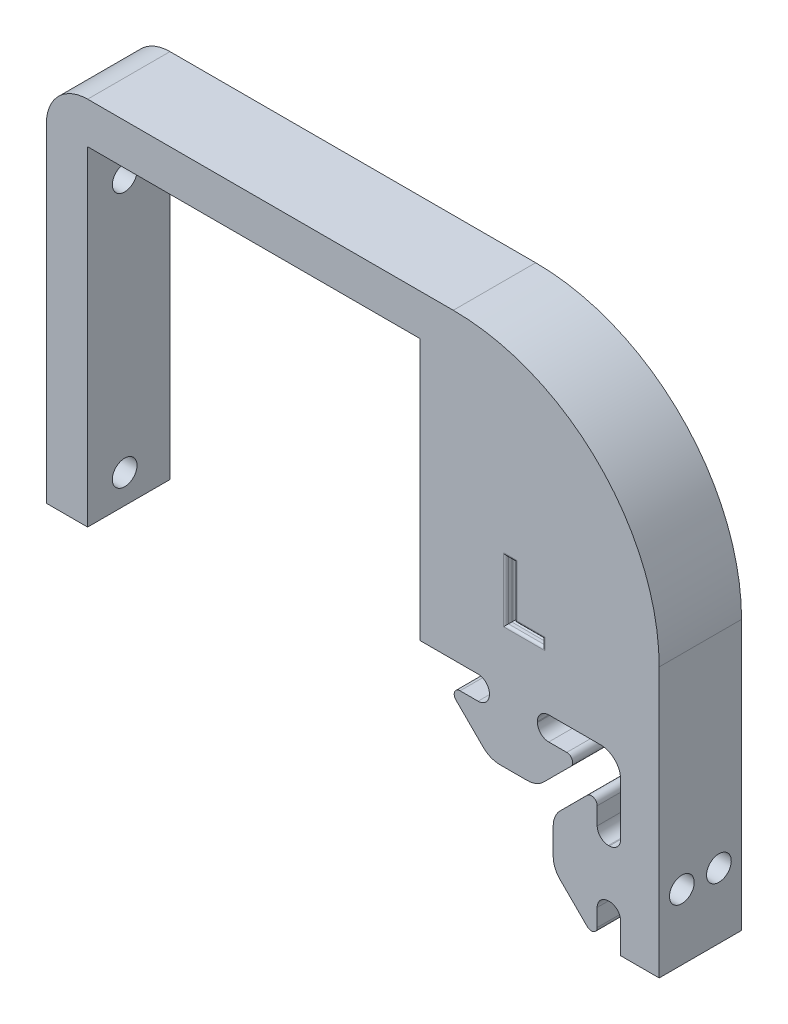
from build123d import *

# Parameters (mm, degrees)
BOSS_EXTRUDE1_DEPTH = 10
CUT_EXTRUDE1_REACH  = 92.069
SKETCH2_R           = 1.5
FILLET3_R           = 5
CUT_EXTRUDE2_REACH  = 92.069
SKETCH3_R           = 1.5
FILLET4_R           = 25
CUT_EXTRUDE7_DEPTH  = 1
FILLET8_R           = 0.3
SKETCH8_W           = 10
SKETCH8_H           = 31.75
BOSS_EXTRUDE2_DEPTH = 0.8


with BuildPart() as part:
    # Sketch1 → Boss-Extrude1 (new body)
    with BuildSketch(Plane.XY):
        with BuildLine():
            Line((13.02, -7.9417418), (17.7, -7.9417418))
            Line((17.7, -7.9417418), (17.7, 49.77))
            Line((17.7, 49.77), (-56.7, 49.77))
            Line((-56.7, 49.77), (-56.7, 4.77))
            Line((-56.7, 4.77), (-51.7, 4.77))
            Line((-51.7, 4.77), (-51.7, 44.77))
            Line((-51.7, 44.77), (-10.566443095, 44.77))
            Line((-10.566443095, 44.77), (-10.566443095, 13.02))
            Line((-10.566443095, 13.02), (-5.317126718, 13.02))
            Line((-5.317126718, 13.02), (-4.287512407, 13.02))
            ThreePointArc((-4.287512407, 13.02), (-3.319474451, 12.619025549), (-2.9185, 11.650987593))
            Line((-2.9185, 11.650987593), (-2.9185, 11.539212407))
            ThreePointArc((-2.9185, 11.539212407), (-3.319474451, 10.571174451), (-4.287512407, 10.1702))
            Line((-4.287512407, 10.1702), (-6.476788598, 10.1702))
            ThreePointArc((-6.476788598, 10.1702), (-7.136510935, 9.729114651), (-6.981020848, 8.950903446))
            Line((-6.981020848, 8.950903446), (-3.672257405, 5.649701928))
            ThreePointArc((-3.672257405, 5.649701928), (-2.746830644, 5.032499411), (-1.655778399, 4.8158))
            Line((-1.655778399, 4.8158), (1.655778399, 4.8158))
            ThreePointArc((1.655778399, 4.8158), (2.746830644, 5.032499411), (3.672257405, 5.649701928))
            Line((3.672257405, 5.649701928), (6.981020848, 8.950903446))
            ThreePointArc((6.981020848, 8.950903446), (7.136510935, 9.729114651), (6.476788598, 10.1702))
            Line((6.476788598, 10.1702), (4.287512407, 10.1702))
            ThreePointArc((4.287512407, 10.1702), (3.319474451, 10.571174451), (2.9185, 11.539212407))
            Line((2.9185, 11.539212407), (2.9185, 11.650987593))
            ThreePointArc((2.9185, 11.650987593), (3.319474451, 12.619025549), (4.287512407, 13.02))
            Line((4.287512407, 13.02), (6.332886163, 13.02))
            Line((6.332886163, 13.02), (10.562594215, 13.019824354))
            ThreePointArc((10.562594215, 13.019824354), (12.303594776, 12.313982883), (13.019956614, 10.577284622))
            Line((13.019956614, 10.577284622), (13.02, 4.287469289))
            ThreePointArc((13.02, 4.287469289), (12.619025549, 3.319431332), (11.650987593, 2.918456882))
            Line((11.650987593, 2.918456882), (11.539212407, 2.918456882))
            ThreePointArc((11.539212407, 2.918456882), (10.571174451, 3.319431332), (10.1702, 4.287469289))
            Line((10.1702, 4.287469289), (10.1702, 6.402089023))
            ThreePointArc((10.1702, 6.402089023), (9.733877283, 7.055496588), (8.963146507, 6.90287605))
            Line((8.963146507, 6.90287605), (5.667020993, 3.614283579))
            ThreePointArc((5.667020993, 3.614283579), (5.046449321, 2.687255303), (4.8285, 1.593185507))
            Line((4.8285, 1.593185507), (4.8285, -1.593185507))
            ThreePointArc((4.8285, -1.593185507), (5.046449321, -2.687255303), (5.667020993, -3.614283579))
            Line((5.667020993, -3.614283579), (8.963146507, -6.90287605))
            ThreePointArc((8.963146507, -6.90287605), (9.733877283, -7.055496588), (10.1702, -6.402089023))
            Line((10.1702, -6.402089023), (10.1702, -4.287469289))
            ThreePointArc((10.1702, -4.287469289), (10.571174451, -3.319431332), (11.539212407, -2.918456882))
            Line((11.539212407, -2.918456882), (11.650987593, -2.918456882))
            ThreePointArc((11.650987593, -2.918456882), (12.619025549, -3.319431332), (13.02, -4.287469289))
            Line((13.02, -4.287469289), (13.02, -5.3170836))
            Line((13.02, -5.3170836), (13.02, -7.9417418))
        make_face()
    extrude(amount=BOSS_EXTRUDE1_DEPTH)

    # Sketch2 → Cut-Extrude1 (cut, up to next)
    with BuildSketch(Plane.ZY.offset(56.7), mode=Mode.PRIVATE) as cut_extrude1_sk1:
        with Locations((5.5, 8.27)):
            Circle(SKETCH2_R)
    cut_extrude1_tool1 = extrude(cut_extrude1_sk1.sketch, amount=-CUT_EXTRUDE1_REACH, mode=Mode.PRIVATE) & part.part
    # Sketch2 → Cut-Extrude1 (cut, up to next)
    with BuildSketch(Plane.ZY.offset(56.7), mode=Mode.PRIVATE) as cut_extrude1_sk2:
        with Locations((5.5, 39.27)):
            Circle(SKETCH2_R)
    cut_extrude1_tool2 = extrude(cut_extrude1_sk2.sketch, amount=-CUT_EXTRUDE1_REACH, mode=Mode.PRIVATE) & part.part
    add(cut_extrude1_tool1.solids().sort_by_distance((-56.7, 8.27, 5.5))[0], mode=Mode.SUBTRACT)
    add(cut_extrude1_tool2.solids().sort_by_distance((-56.7, 39.27, 5.5))[0], mode=Mode.SUBTRACT)

    # Fillet3
    fillet3_edges = [part.edges().sort_by_distance(p)[0] for p in [
        (-56.7, 49.77, 5),
    ]]
    fillet(fillet3_edges, radius=FILLET3_R)

    # Sketch3 → Cut-Extrude2 (cut, up to next)
    with BuildSketch(Plane(origin=(17.7, 0, 0), x_dir=(0, 0, -1), z_dir=(1, 0, 0)), mode=Mode.PRIVATE) as cut_extrude2_sk1:
        with Locations((-7.25, 0)):
            Circle(SKETCH3_R)
    cut_extrude2_tool1 = extrude(cut_extrude2_sk1.sketch, amount=-CUT_EXTRUDE2_REACH, mode=Mode.PRIVATE) & part.part
    # Sketch3 → Cut-Extrude2 (cut, up to next)
    with BuildSketch(Plane(origin=(17.7, 0, 0), x_dir=(0, 0, -1), z_dir=(1, 0, 0)), mode=Mode.PRIVATE) as cut_extrude2_sk2:
        with Locations(Location((-2.75, 0, 0), (0, 0, 90))):
            Circle(SKETCH3_R)
    cut_extrude2_tool2 = extrude(cut_extrude2_sk2.sketch, amount=-CUT_EXTRUDE2_REACH, mode=Mode.PRIVATE) & part.part
    add(cut_extrude2_tool1.solids().sort_by_distance((17.7, 0, 7.25))[0], mode=Mode.SUBTRACT)
    add(cut_extrude2_tool2.solids().sort_by_distance((17.7, 0, 2.75))[0], mode=Mode.SUBTRACT)

    # Fillet4
    fillet4_edges = [part.edges().sort_by_distance(p)[0] for p in [
        (17.7, 49.77, 5),
    ]]
    fillet(fillet4_edges, radius=FILLET4_R)

    # Sketch7 → Cut-Extrude7 (cut)
    with BuildSketch(Plane.XY.offset(10)):
        Polygon((-0.90100078, 19.84300121), (-0.90100078, 27.034293528), (0.113155829, 27.034293528), (0.113155829, 20.672765708), (3.524409877, 20.672765708), (3.524409877, 19.84300121), align=None)
    extrude(amount=-CUT_EXTRUDE7_DEPTH, mode=Mode.SUBTRACT)

    # Fillet8
    fillet8_edges = [part.edges().sort_by_distance(p)[0] for p in [
        (1.311704549, 19.84300121, 10),
        (-0.90100078, 23.438647369, 10),
        (-0.393922475, 27.034293528, 10),
        (0.113155829, 23.853529618, 10),
        (1.818782853, 20.672765708, 10),
        (3.524409877, 20.257883459, 10),
        (1.311704549, 19.84300121, 9),
        (-0.90100078, 23.438647369, 9),
        (-0.393922475, 27.034293528, 9),
        (0.113155829, 23.853529618, 9),
        (1.818782853, 20.672765708, 9),
        (3.524409877, 20.257883459, 9),
    ]]
    fillet(fillet8_edges, radius=FILLET8_R)

    # Sketch8 → Boss-Extrude2 (add)
    with BuildSketch(Plane.ZY.offset(10.566443095)):
        with Locations((5, 28.895)):
            Rectangle(SKETCH8_W, SKETCH8_H)
    extrude(amount=BOSS_EXTRUDE2_DEPTH)


solid = part.part
